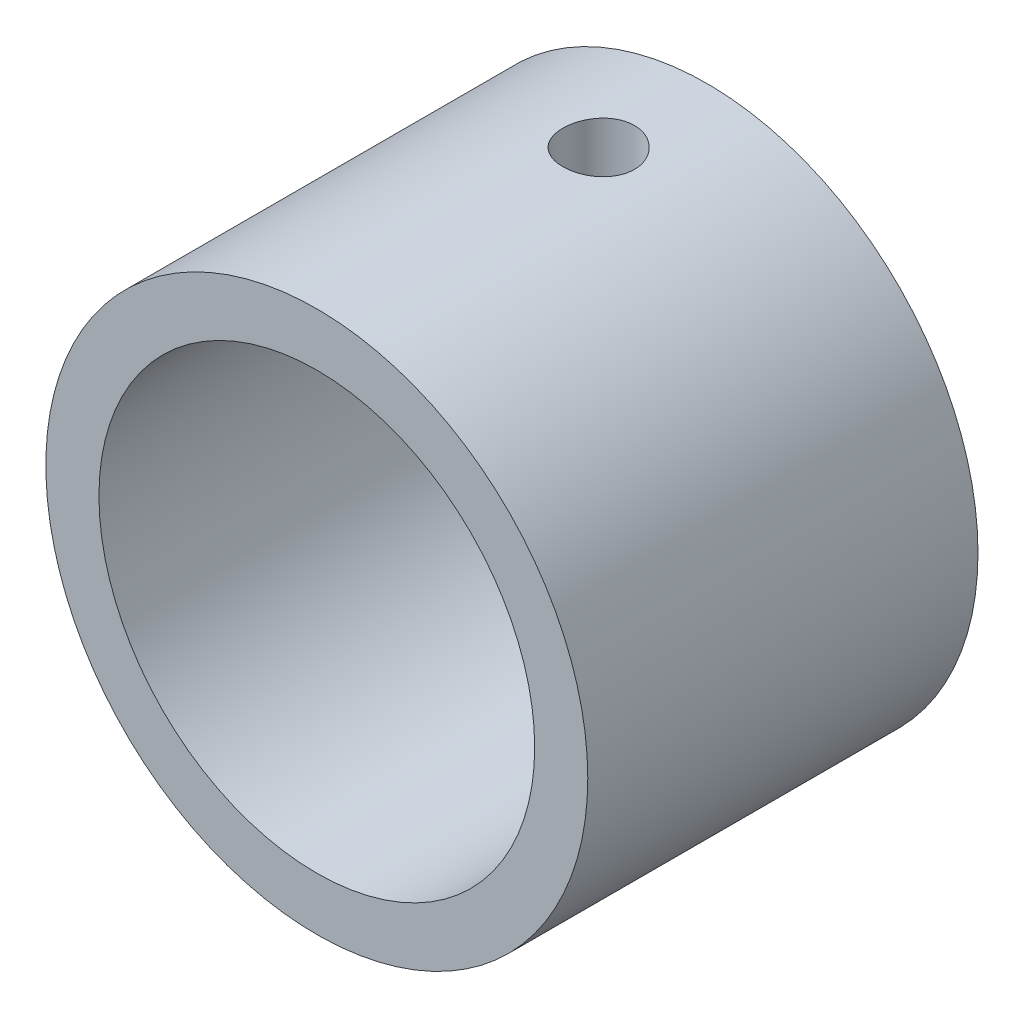
from build123d import *

# Parameters (mm, degrees)
SKETCH1_R               = 12.5
BOSS_EXTRUDE1_DEPTH     = 18
CUT_EXTRUDE1_DEPTH      = 26.228951623
CUT_EXTRUDE1_DEPTH_BACK = 26.228951623
SKETCH2_R               = 10.05
CUT_EXTRUDE2_DEPTH      = 34.24530042
CUT_EXTRUDE2_DEPTH_BACK = 34.24530042
SKETCH6_R               = 1.65


with BuildPart() as part:
    # Sketch1 → Boss-Extrude1 (new body)
    with BuildSketch(Plane.XY):
        Circle(SKETCH1_R)
    extrude(amount=BOSS_EXTRUDE1_DEPTH)

    # Sketch2 → Cut-Extrude1 (cut, two sides: drawn at the far end of the back side and taken through both)
    with BuildSketch(Plane.XY.offset(18).offset(-CUT_EXTRUDE1_DEPTH_BACK)):
        Circle(SKETCH2_R)
    extrude(amount=CUT_EXTRUDE1_DEPTH + CUT_EXTRUDE1_DEPTH_BACK, mode=Mode.SUBTRACT)

    # Sketch6 → Cut-Extrude2 (cut, two sides: drawn at the far end of the back side and taken through both)
    with BuildSketch(Plane(origin=(0, -12.5, 0), x_dir=(-1, 0, 0), z_dir=(0, -1, 0)).offset(-CUT_EXTRUDE2_DEPTH_BACK)):
        with Locations(Location((0, -5, 0), (0, 0, 90))):
            Circle(SKETCH6_R)
    extrude(amount=CUT_EXTRUDE2_DEPTH + CUT_EXTRUDE2_DEPTH_BACK, mode=Mode.SUBTRACT)


solid = part.part
